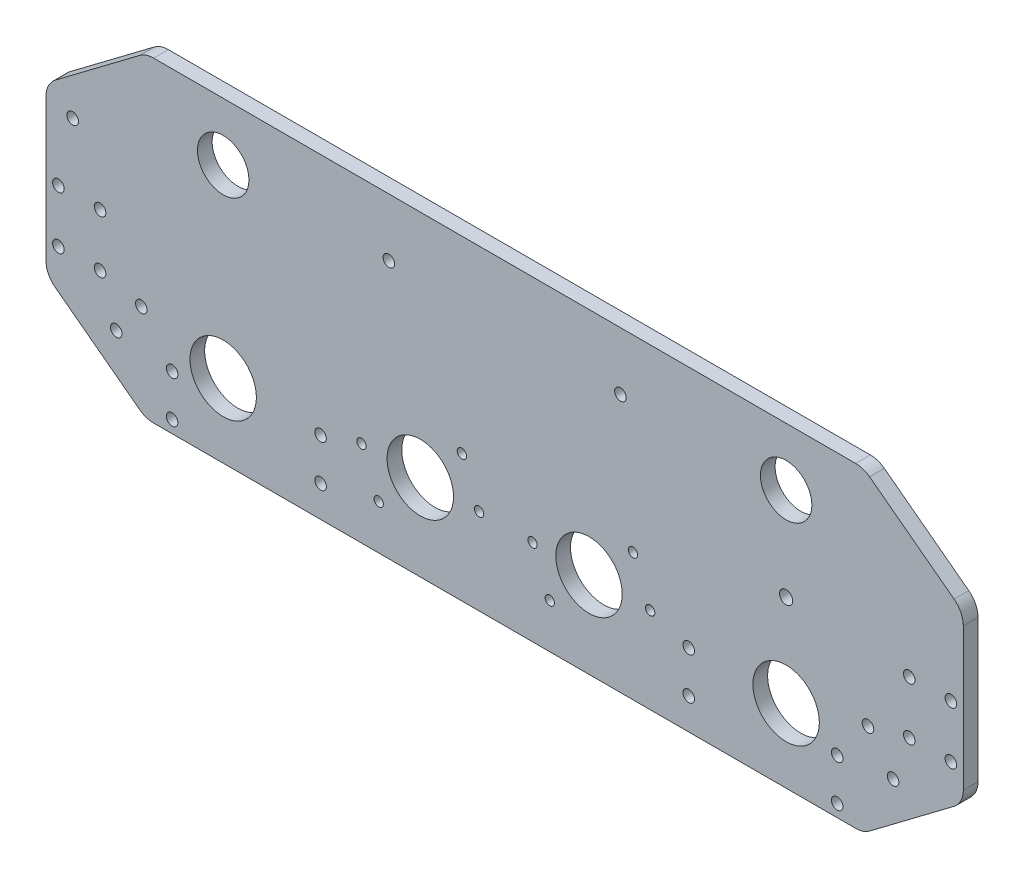
from build123d import *

# Parameters (mm, degrees)
SALIENTE_EXTRUIR1_DEPTH    = 6.35
REDONDEO1_R                = 10
CROQUIS2_R                 = 14.345
CORTAR_EXTRUIR1_DEPTH      = 10
CORTAR_EXTRUIR2_DEPTH      = 241.691916085
CORTAR_EXTRUIR2_DEPTH_BACK = 241.691916085
CROQUIS8_R                 = 14.345
CROQUIS8_R_2               = 2.01
CROQUIS8_R_3               = 2.02
CHAFL_N3_SIZE              = 1
CROQUIS9_R                 = 11.1125
CORTAR_EXTRUIR3_DEPTH      = 10
CROQUIS10_R                = 2.5
CROQUIS10_R_2              = 2.843216267
CORTAR_EXTRUIR4_DEPTH      = 10
CROQUIS11_R                = 2.5
CORTAR_EXTRUIR5_DEPTH      = 10


with BuildPart() as part:
    # Croquis1 → Saliente-Extruir1 (new body)
    with BuildSketch(Plane.XY):
        Polygon((155, 0), (-155, 0), (-198.126317543, 32.49801125), (-198.126317543, 104.023922026), (-155, 136.521933277), (155, 136.521933277), (198.126317543, 104.023922026), (198.126317543, 32.49801125), align=None)
    extrude(amount=SALIENTE_EXTRUIR1_DEPTH)

    # Redondeo1
    redondeo1_edges = [part.edges().sort_by_distance(p)[0] for p in [
        (198.126317543, 32.49801125, 3.175),
        (155, 0, 3.175),
        (-155, 0, 3.175),
        (-198.126317543, 32.49801125, 3.175),
        (198.126317543, 104.023922026, 3.175),
        (155, 136.521933277, 3.175),
        (-155, 136.521933277, 3.175),
        (-198.126317543, 104.023922026, 3.175),
    ]]
    fillet(redondeo1_edges, radius=REDONDEO1_R)

    # Croquis2 → Cortar-Extruir1 (cut)
    with BuildSketch(Plane.XY.offset(6.35)):
        with Locations((-121.592420883, 31.75)):
            Circle(CROQUIS2_R)
        with Locations((121.592420883, 31.75)):
            Circle(CROQUIS2_R)
    extrude(amount=-CORTAR_EXTRUIR1_DEPTH, mode=Mode.SUBTRACT)

    # Croquis8 → Cortar-Extruir2 (cut, two sides: drawn at the far end of the back side and taken through both)
    with BuildSketch(Plane.XY.offset(6.35).offset(-CORTAR_EXTRUIR2_DEPTH_BACK)):
        with Locations((-36.442420883, 37.2)):
            Circle(CROQUIS8_R)
        with Locations((36.442420883, 37.2)):
            Circle(CROQUIS8_R)
        with Locations((12.057209477, 37.2)):
            Circle(CROQUIS8_R_2)
        with Locations((19.496697235, 19.239487758)):
            Circle(CROQUIS8_R_2)
        with Locations((62.857209477, 37.2)):
            Circle(CROQUIS8_R_2)
        with Locations((55.417721719, 55.160512242)):
            Circle(CROQUIS8_R_2)
        with Locations((-18.48190864, 55.160512242)):
            Circle(CROQUIS8_R_3)
        with Locations((-11.042420883, 37.2)):
            Circle(CROQUIS8_R_3)
        with Locations((-54.402933125, 19.239487758)):
            Circle(CROQUIS8_R_3)
        with Locations((-61.842420883, 37.2)):
            Circle(CROQUIS8_R_3)
        with Locations((-121.592420883, 31.75)):
            Circle(CROQUIS8_R)
    extrude(amount=CORTAR_EXTRUIR2_DEPTH + CORTAR_EXTRUIR2_DEPTH_BACK, mode=Mode.SUBTRACT)

    # Chaflán3
    chafl_n3_edges = [part.edges().sort_by_distance(p)[0] for p in [
        (-63.862420883, 37.2, 0),
        (10.047209477, 37.2, 0),
        (-13.062420883, 37.2, 0),
        (-20.50190864, 55.160512242, 0),
        (-56.422933125, 19.239487758, 0),
        (53.407721719, 55.160512242, 0),
        (60.847209477, 37.2, 0),
        (17.486697235, 19.239487758, 0),
    ]]
    chamfer(chafl_n3_edges, length=CHAFL_N3_SIZE)

    # Croquis9 → Cortar-Extruir3 (cut)
    with BuildSketch(Plane(origin=(0, 0, 0), x_dir=(-1, 0, 0), z_dir=(0, 0, -1))):
        with Locations((-121.592420883, 111.521933277)):
            Circle(CROQUIS9_R)
        with Locations(Location((121.592420883, 111.521933277, 0), (0, 0, 180))):
            Circle(CROQUIS9_R)
    extrude(amount=-CORTAR_EXTRUIR3_DEPTH, mode=Mode.SUBTRACT)

    # Croquis10 → Cortar-Extruir4 (cut)
    with BuildSketch(Plane(origin=(0, 0, 0), x_dir=(-1, 0, 0), z_dir=(0, 0, -1))):
        with Locations((-50, 111.521933277)):
            Circle(CROQUIS10_R)
        with Locations(Location((50, 111.521933277, 0), (0, 0, 180))):
            Circle(CROQUIS10_R)
        with Locations((-121.592420883, 71.461933277)):
            Circle(CROQUIS10_R_2)
        with Locations((186.592420883, 96.521933277)):
            Circle(CROQUIS10_R)
    extrude(amount=-CORTAR_EXTRUIR4_DEPTH, mode=Mode.SUBTRACT)

    # Croquis11 → Cortar-Extruir5 (cut)
    with BuildSketch(Plane.XY.offset(6.35)):
        with Locations((-143.654046805, 23.35)):
            Circle(CROQUIS11_R)
        with Locations((-143.654046805, 5.35)):
            Circle(CROQUIS11_R)
        with Locations((-79.522420883, 31.5)):
            Circle(CROQUIS11_R)
        with Locations((-79.522420883, 13.5)):
            Circle(CROQUIS11_R)
        with Locations((143.654046805, 5.35)):
            Circle(CROQUIS11_R)
        with Locations((143.654046805, 23.35)):
            Circle(CROQUIS11_R)
        with Locations((79.522420883, 13.5)):
            Circle(CROQUIS11_R)
        with Locations((79.522420883, 31.5)):
            Circle(CROQUIS11_R)
        with Locations((-174.776317543, 45.483827331)):
            Circle(CROQUIS11_R)
        with Locations((-192.776317543, 45.483827331)):
            Circle(CROQUIS11_R)
        with Locations((-174.776317543, 68.260966638)):
            Circle(CROQUIS11_R)
        with Locations((-192.776317543, 68.260966638)):
            Circle(CROQUIS11_R)
        with Locations((174.776317543, 45.483827331)):
            Circle(CROQUIS11_R)
        with Locations((192.776317543, 45.483827331)):
            Circle(CROQUIS11_R)
        with Locations((192.776317543, 68.260966638)):
            Circle(CROQUIS11_R)
        with Locations((174.776317543, 68.260966638)):
            Circle(CROQUIS11_R)
        with Locations((-156.951159176, 40.912577131)):
            Circle(CROQUIS11_R)
        with Locations((-167.783829593, 26.537137951)):
            Circle(CROQUIS11_R)
        with Locations((167.783829593, 26.537137951)):
            Circle(CROQUIS11_R)
        with Locations((156.951159176, 40.912577131)):
            Circle(CROQUIS11_R)
    extrude(amount=-CORTAR_EXTRUIR5_DEPTH, mode=Mode.SUBTRACT)


solid = part.part
